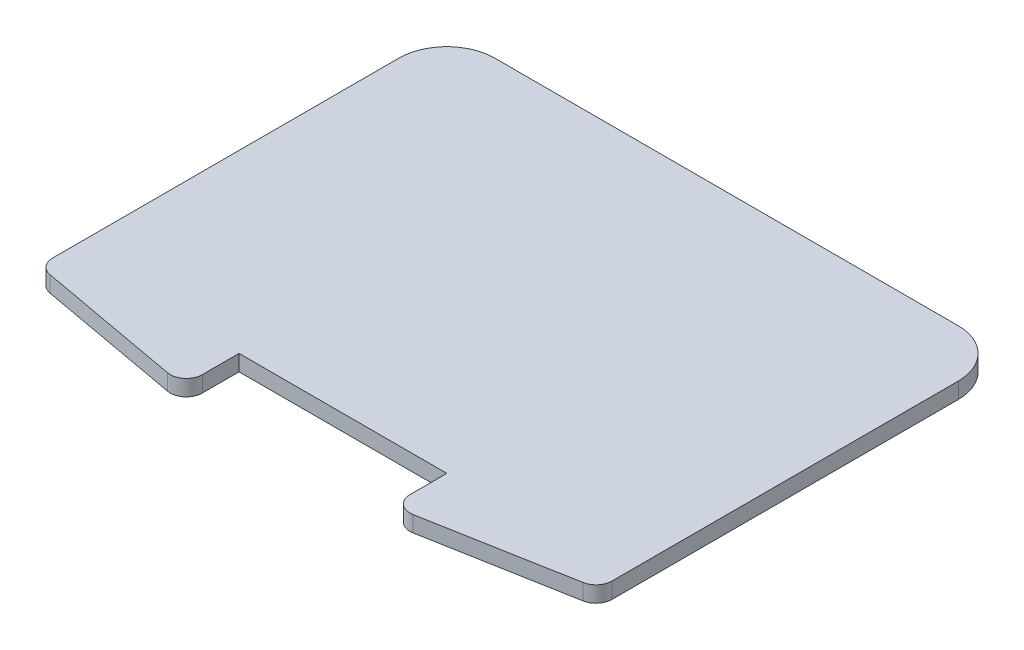
from build123d import *

# Parameters (mm, degrees)
SKETCH_1_W          = 35
SKETCH_1_H          = 25.5
EXTRUDE_1_DEPTH     = 1
EXTRUDE_2_DEPTH     = 1
SKETCH_3_W          = 13
SKETCH_3_H          = 1.5
CUT_EXTRUDE_1_DEPTH = 23.908786524
FILLET_1_R          = 3
FILLET_2_R          = 1


with BuildPart() as part:
    # 草图1 → 凸台-拉伸1 (new body)
    with BuildSketch(Plane(origin=(0, 0, 0), x_dir=(1, 0, 0), z_dir=(0, 1, 0))):
        Rectangle(SKETCH_1_W, SKETCH_1_H)
    extrude(amount=EXTRUDE_1_DEPTH)

    # 草图2 → 凸台-拉伸2 (add)
    with BuildSketch(Plane(origin=(0, 1, 0), x_dir=(1, 0, 0), z_dir=(0, 1, 0))):
        Polygon((-17.5, -12.75), (-6.5, -14.75), (-6.5, -12.75), align=None)
        Polygon((17.5, -12.75), (6.5, -12.75), (6.5, -14.75), align=None)
    extrude(amount=-EXTRUDE_2_DEPTH)

    # 草图3 → 切除-拉伸1 (cut, through all)
    with BuildSketch(Plane(origin=(0, 1, 0), x_dir=(1, 0, 0), z_dir=(0, 1, 0))):
        with Locations((0, -12)):
            Rectangle(SKETCH_3_W, SKETCH_3_H)
    extrude(amount=-CUT_EXTRUDE_1_DEPTH, mode=Mode.SUBTRACT)

    # 圆角1
    fillet_1_edges = [part.edges().sort_by_distance(p)[0] for p in [
        (-17.5, 0.5, -12.75),
        (17.5, 0.5, -12.75),
    ]]
    fillet(fillet_1_edges, radius=FILLET_1_R)

    # 圆角2
    fillet_2_edges = [part.edges().sort_by_distance(p)[0] for p in [
        (-6.5, 0.5, 14.75),
        (6.5, 0.5, 14.75),
        (17.5, 0.5, 12.75),
        (-17.5, 0.5, 12.75),
    ]]
    fillet(fillet_2_edges, radius=FILLET_2_R)


solid = part.part
